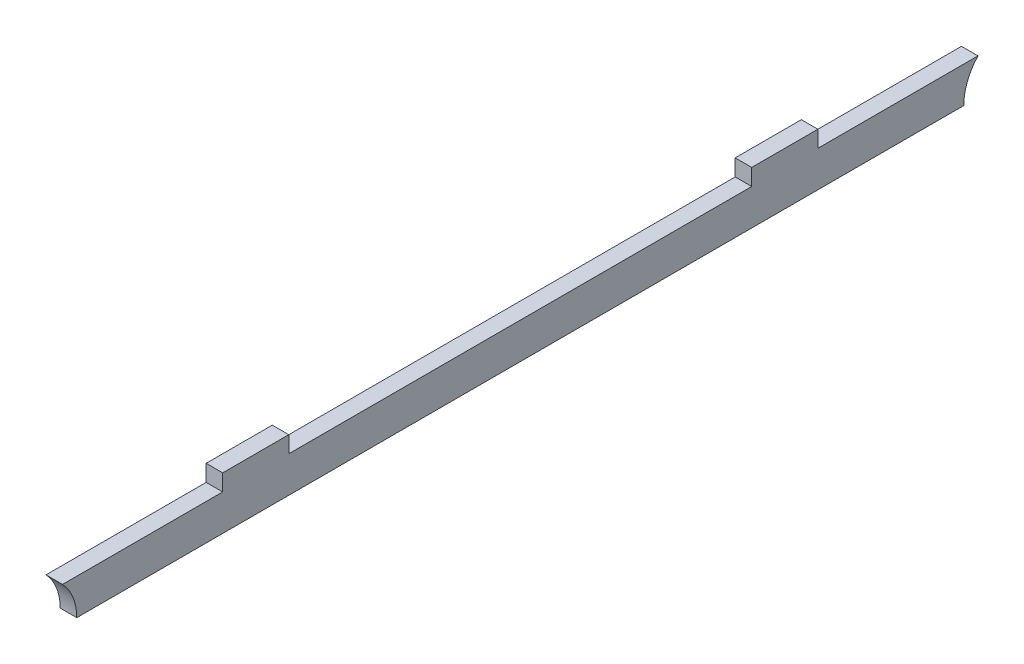
from build123d import *

# Parameters (mm, degrees)
BOSS_EXTRUDE1_DEPTH = 2.5


with BuildPart() as part:
    # Sketch1 → Boss-Extrude1 (new, symmetric)
    with BuildSketch(Plane(origin=(0, 0, 0), x_dir=(0, 0, -1), z_dir=(1, 0, 0))):
        with BuildLine():
            Line((-90, 10.875), (-138.434966494, 10.875))
            ThreePointArc((-138.434966494, 10.875), (-135.24177294, 5.848962219), (-134.125, 0))
            Line((-134.125, 0), (134.125, 0))
            ThreePointArc((134.125, 0), (135.24177294, 5.848962219), (138.434966494, 10.875))
            Line((138.434966494, 10.875), (90, 10.875))
            Line((90, 10.875), (90, 15.875))
            Line((90, 15.875), (70, 15.875))
            Line((70, 15.875), (70, 10.875))
            Line((70, 10.875), (-70, 10.875))
            Line((-70, 10.875), (-70, 15.875))
            Line((-70, 15.875), (-90, 15.875))
            Line((-90, 15.875), (-90, 10.875))
        make_face()
    extrude(amount=BOSS_EXTRUDE1_DEPTH, both=True)


solid = part.part
